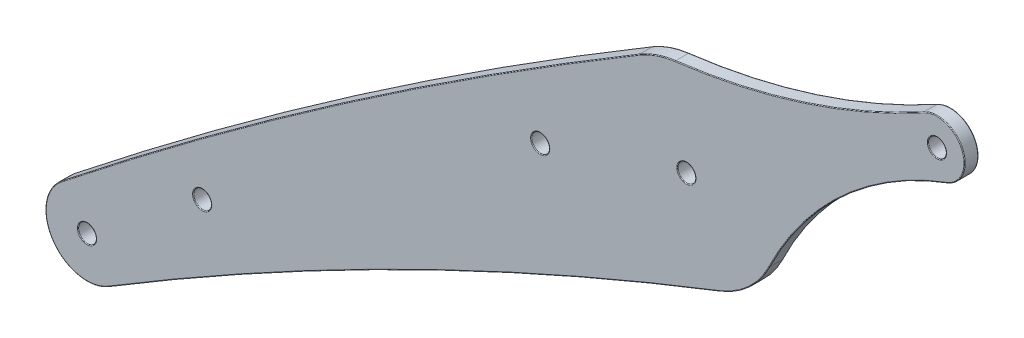
from build123d import *

# Parameters (mm, degrees)
BOSS_EXTRUDE1_DEPTH    = 3
M3_5_CLEARANCE_HOLE1_D = 3.9
FILLET1_R              = 0.15


with BuildPart() as part:
    # Sketch1 → Boss-Extrude1 (new body)
    with BuildSketch(Plane.XY):
        with BuildLine():
            ThreePointArc((-59.297249152, 220.822035994), (-31.504896521, 226.934874667), (-5.367115741, 238.186455766))
            ThreePointArc((-5.367115741, 238.186455766), (2.972136848, 235.424225962), (-0.382111858, 227.304985675))
            ThreePointArc((-0.382111858, 227.304985675), (-23.007979751, 213.489381006), (-38.873666857, 192.250718079))
            ThreePointArc((-38.873666857, 192.250718079), (-43.305888298, 186.27498927), (-49.615619513, 182.332754662))
            ThreePointArc((-49.615619513, 182.332754662), (-117.397572559, 152.47377549), (-182.322813029, 116.827387931))
            ThreePointArc((-182.322813029, 116.827387931), (-194.380984924, 119.37928007), (-192.58495253, 131.572964115))
            ThreePointArc((-192.58495253, 131.572964115), (-131.286441458, 176.941553639), (-67.115779179, 218.147651217))
            ThreePointArc((-67.115779179, 218.147651217), (-63.346139966, 219.893037865), (-59.297249152, 220.822035994))
        make_face()
    extrude(amount=-BOSS_EXTRUDE1_DEPTH)

    # M3.5 Clearance Hole1 (through all)
    with Locations(Plane.XY):
        with Locations((-186.993859237, 124.520328027), (-161.993859237, 143.416067608), (-88.623199998, 190.664661821), (-56.873199998, 200.969479844), (-2.482695658, 232.925265712)):
            Hole(M3_5_CLEARANCE_HOLE1_D / 2)

    # Fillet1
    fillet1_edges = [part.edges().sort_by_distance(p)[0] for p in [
        (-117.397572559, 152.47377549, 0),
        (-194.380984924, 119.37928007, 0),
        (-131.286441458, 176.941553639, 0),
        (-63.346139966, 219.893037865, 0),
        (-194.380984924, 119.37928007, -3),
        (-117.397572559, 152.47377549, -3),
        (-43.305888298, 186.27498927, -3),
        (-23.007979751, 213.489381006, -3),
        (-0.532695658, 232.925265712, 0),
        (-0.532695658, 232.925265712, -3),
        (2.972136848, 235.424225962, -3),
        (-31.504896521, 226.934874667, -3),
        (-54.923199998, 200.969479844, 0),
        (-54.923199998, 200.969479844, -3),
        (-86.673199998, 190.664661821, 0),
        (-86.673199998, 190.664661821, -3),
        (-160.043859237, 143.416067608, 0),
        (-160.043859237, 143.416067608, -3),
        (-185.043859237, 124.520328027, 0),
        (-185.043859237, 124.520328027, -3),
        (-63.346139966, 219.893037865, -3),
        (-31.504896521, 226.934874667, 0),
        (-131.286441458, 176.941553639, -3),
        (2.972136848, 235.424225962, 0),
        (-23.007979751, 213.489381006, 0),
        (-43.305888298, 186.27498927, 0),
    ]]
    fillet(fillet1_edges, radius=FILLET1_R)


solid = part.part
